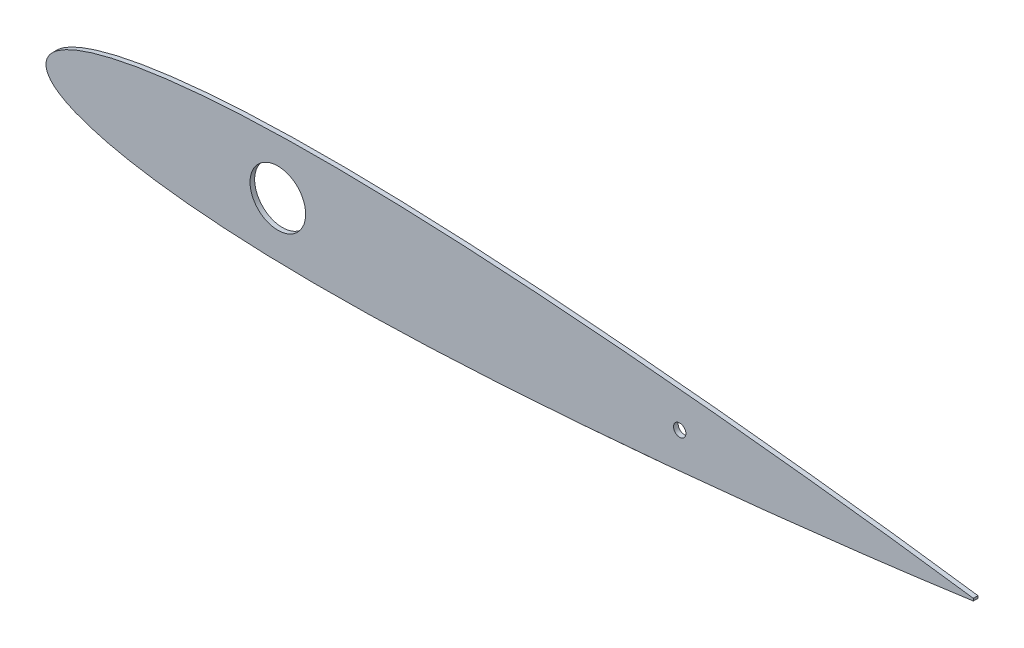
from build123d import *

# Parameters (mm, degrees)
BOSS_EXTRUDE1_DEPTH = 1.5
SKETCH7_R           = 9
SKETCH7_R_2         = 2
CUT_EXTRUDE7_DEPTH  = 301.543472003


with BuildPart() as part:
    # Sketch5 → Boss-Extrude1 (new body)
    with BuildSketch(Plane.XY):
        with BuildLine():
            Line((300, 0.378), (300, -0.378))
            add(Edge.make_bspline(
                [(300, 0.378), (299.270406424, 0.479445822), (297.234667094, 0.762503754), (293.659650161, 1.257673506), (289.112411795, 1.874242443), (284.080816659, 2.54451744), (278.752044218, 3.238122316), (273.265899022, 3.934946436), (267.705955472, 4.629019943), (262.11456302, 5.313069107), (256.508348909, 5.982191812), (250.891738994, 6.637990809), (245.269556965, 7.281779235), (239.647345349, 7.912232764), (234.025130107, 8.526992046), (228.399087903, 9.126229764), (222.768257645, 9.713077606), (217.135920793, 10.28745981), (211.505410154, 10.846941084), (205.877619803, 11.391642827), (200.251512374, 11.920884624), (194.626420536, 12.434617078), (189.002797137, 12.931911809), (183.381530938, 13.413097581), (177.763225616, 13.876376701), (172.148301533, 14.321237194), (166.537529462, 14.747820918), (160.931736194, 15.154228144), (155.33170885, 15.539100856), (149.737538345, 15.902649564), (144.148688279, 16.241846119), (138.565679604, 16.557420546), (132.990859803, 16.847397555), (127.42743944, 17.110211679), (121.877619637, 17.343891718), (116.340758577, 17.545256813), (110.815476382, 17.71267912), (105.301273398, 17.844497938), (99.800570116, 17.940091813), (94.317435844, 17.996590439), (88.855764067, 18.010124458), (83.418647975, 17.97923384), (78.008480827, 17.899160713), (72.628455365, 17.767033787), (67.282738746, 17.579413934), (61.977364895, 17.331515489), (56.720691016, 17.021032651), (51.525175322, 16.64095807), (46.408202619, 16.190188591), (41.394176065, 15.661669099), (36.515671087, 15.053963784), (31.819009441, 14.365623605), (27.366164829, 13.603475684), (23.235217954, 12.782583444), (19.502642451, 11.920250751), (16.218271393, 11.044597796), (13.389186016, 10.175076255), (10.984929333, 9.333498715), (8.961561478, 8.522062882), (7.267292053, 7.746976002), (5.846052466, 7.010625622), (4.647711085, 6.300634033), (3.628235251, 5.606513668), (2.751909197, 4.926635252), (2.00625736, 4.249917259), (1.390586137, 3.570259492), (0.901000435, 2.890942252), (0.529275535, 2.220219273), (0.260479537, 1.566458936), (0.085712654, 0.931035928), (-0.003509247, 0.308981015), (-0.003509247, -0.308981015), (0.085712654, -0.931035928), (0.260479537, -1.566458936), (0.529275535, -2.220219273), (0.901000435, -2.890942252), (1.390586137, -3.570259492), (2.00625736, -4.249917259), (2.751909197, -4.926635252), (3.628235251, -5.606513668), (4.647711085, -6.300634033), (5.846052466, -7.010625622), (7.267292053, -7.746975999), (8.961561475, -8.522062895), (10.984929344, -9.333498651), (13.389185965, -10.175076559), (16.21827163, -11.044596377), (19.502641361, -11.92025728), (23.235222799, -12.782554413), (27.366127559, -13.603596161), (31.819075008, -14.365113363), (36.515634637, -15.054106097), (41.394182204, -15.661628887), (46.408200924, -16.190199694), (51.525175786, -16.640955027), (56.720690889, -17.02103348), (61.977364929, -17.331515263), (67.282738736, -17.579413995), (72.628455367, -17.767033771), (78.008480826, -17.899160717), (83.418647975, -17.979233839), (88.855764067, -18.010124458), (94.317435844, -17.996590438), (99.800570116, -17.940091813), (105.301273398, -17.844497938), (110.815476382, -17.71267912), (116.340758577, -17.545256813), (121.877619637, -17.343891718), (127.42743944, -17.110211679), (132.990859803, -16.847397555), (138.565679604, -16.557420546), (144.148688279, -16.241846119), (149.737538345, -15.902649564), (155.33170885, -15.539100856), (160.931736194, -15.154228144), (166.537529462, -14.747820918), (172.148301533, -14.321237194), (177.763225616, -13.876376701), (183.381530938, -13.413097581), (189.002797137, -12.931911809), (194.626420536, -12.434617078), (200.251512374, -11.920884624), (205.877619803, -11.391642827), (211.505410154, -10.846941084), (217.135920793, -10.28745981), (222.768257645, -9.713077606), (228.399087903, -9.126229764), (234.025130107, -8.526992046), (239.647345349, -7.912232764), (245.269556965, -7.281779235), (250.891738994, -6.637990809), (256.508348909, -5.982191812), (262.11456302, -5.313069107), (267.705955472, -4.629019943), (273.265899022, -3.934946436), (278.752044218, -3.238122316), (284.080816659, -2.54451744), (289.112411795, -1.874242443), (293.659650161, -1.257673506), (297.234667094, -0.762503754), (299.270406424, -0.479445822), (300, -0.378)],
                knots=[0, 0, 0, 0, 0.003612221, 0.010078953, 0.017698618, 0.026115111, 0.034970966, 0.04405038, 0.05323433, 0.06244757, 0.071673993, 0.080921319, 0.090177538, 0.099424342, 0.108664441, 0.117912199, 0.127169502, 0.136426595, 0.145675426, 0.154916495, 0.164153237, 0.173386649, 0.182615736, 0.191838089, 0.201053134, 0.210260393, 0.219458942, 0.228646747, 0.237822316, 0.246985224, 0.256137384, 0.265279416, 0.27440695, 0.283512193, 0.292591781, 0.301646285, 0.310681793, 0.319699068, 0.32869452, 0.33766016, 0.346588583, 0.355477412, 0.364322937, 0.373121614, 0.381867635, 0.390553005, 0.399166026, 0.407689628, 0.416098119, 0.424354887, 0.432412429, 0.440204728, 0.447630505, 0.454563638, 0.460855379, 0.466413319, 0.47122861, 0.475365774, 0.47890126, 0.481915077, 0.484498872, 0.486747127, 0.488741252, 0.490543179, 0.492182104, 0.493672831, 0.495031908, 0.49627906, 0.497424737, 0.498490166, 0.499502758, 0.500497254, 0.501509846, 0.502575275, 0.503720952, 0.504968104, 0.506327181, 0.507817908, 0.509456832, 0.51125876, 0.513252884, 0.51550114, 0.518084934, 0.521098752, 0.524634237, 0.528771401, 0.533586692, 0.539144632, 0.545436374, 0.552369506, 0.5597952, 0.567587571, 0.575645113, 0.583901881, 0.592310372, 0.600833974, 0.609446995, 0.618132365, 0.626878386, 0.635677063, 0.644522588, 0.653411417, 0.66233984, 0.67130548, 0.680300932, 0.689318207, 0.698353715, 0.707408219, 0.716487807, 0.72559305, 0.734720584, 0.743862616, 0.753014776, 0.762177684, 0.771353253, 0.780541058, 0.789739607, 0.798946866, 0.808161911, 0.817384264, 0.826613351, 0.835846763, 0.845083505, 0.854324574, 0.863573405, 0.872830498, 0.882087801, 0.891335559, 0.900575658, 0.909822462, 0.919078681, 0.928326007, 0.93755243, 0.94676567, 0.95594962, 0.965029034, 0.973884889, 0.982301382, 0.989921047, 0.996387779, 1, 1, 1, 1], degree=3))
        make_face()
    extrude(amount=BOSS_EXTRUDE1_DEPTH)

    # Sketch7 → Cut-Extrude7 (cut, through all)
    with BuildSketch(Plane.XY.offset(1.5)):
        with Locations((75, 0)):
            Circle(SKETCH7_R)
        with Locations((205, 0)):
            Circle(SKETCH7_R_2)
    extrude(amount=-CUT_EXTRUDE7_DEPTH, mode=Mode.SUBTRACT)


solid = part.part
